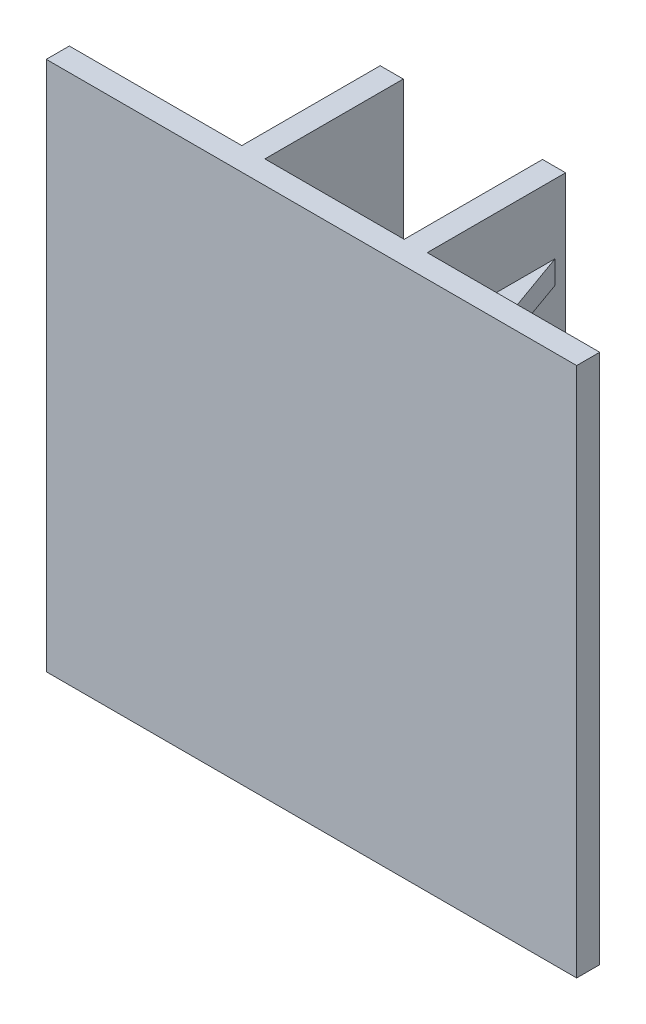
from build123d import *

# Parameters (mm, degrees)
SKETCH_1_W               = 5
SKETCH_1_H               = 115
EXTRUDE_1_DEPTH          = 30
EXTRUDE_1_2_DEPTH        = 30
SKETCH_1_3_W             = 115
SKETCH_1_3_H             = 115
EXTRUDE_2_DEPTH          = 5
CUT_EXTRUDE_1_DEPTH      = 22.5
RIB_1_REACH              = 88.675
SKETCH_4_WALL_W          = 214.94733798
SKETCH_4_WALL_H          = 5
RIB_2_REACH              = 119.1
SKETCH_7_WALL_W          = 265.932906068
SKETCH_7_WALL_H          = 5
MIRROR_3_COPY_1_REACH    = 119.1
MIRROR_3_COPY_1_SKETCH_W = 265.932906068
MIRROR_3_COPY_1_SKETCH_H = 5
MIRROR_3_COPY_2_REACH    = 119.1
MIRROR_3_COPY_2_SKETCH_W = 265.932906068
MIRROR_3_COPY_2_SKETCH_H = 5


with BuildPart() as part:
    # 스케치1 → 보스-돌출1 (new body)
    with BuildSketch(Plane.XY):
        with Locations((-17.6, 0)):
            Rectangle(SKETCH_1_W, SKETCH_1_H)
    extrude(amount=-EXTRUDE_1_DEPTH)



with BuildPart() as body_2:
    # 스케치1 → Extrude 1 2 (new body)
    with BuildSketch(Plane.XY):
        with Locations((17.6, 0)):
            Rectangle(SKETCH_1_W, SKETCH_1_H)
    extrude(amount=-EXTRUDE_1_2_DEPTH)


with BuildPart() as part_1:
    add(part.part)

    add(body_2.part)  # 보스-돌출2 merges body 2
    # 스케치1<3> → 보스-돌출2 (add)
    with BuildSketch(Plane.XY):
        Rectangle(SKETCH_1_3_W, SKETCH_1_3_H)
    extrude(amount=EXTRUDE_2_DEPTH)

    # 스케치3 → 컷-돌출1 (cut, symmetric)
    with BuildSketch(Plane(origin=(0, 0, 0), x_dir=(0, 0, -1), z_dir=(1, 0, 0))):
        with BuildLine():
            Line((15, 24), (30, 24))
            Line((30, 24), (30, 16))
            Line((30, 16), (15, 16))
            ThreePointArc((15, 16), (11, 20), (15, 24))
        make_face()
        with BuildLine():
            Line((30, -16), (30, -24))
            Line((30, -24), (15, -24))
            ThreePointArc((15, -24), (11, -20), (15, -16))
            Line((15, -16), (30, -16))
        make_face()
    extrude(amount=CUT_EXTRUDE_1_DEPTH, both=True, mode=Mode.SUBTRACT)

    # 스케치4 wall → 보강대1 (add, up to next)
    with BuildSketch(Plane(origin=(34, 0, -14), x_dir=(0.707106781187, 0, 0.707106781187), z_dir=(0.707106781187, 0, -0.707106781187)), mode=Mode.PRIVATE) as rib_1_sk1:
        Rectangle(SKETCH_4_WALL_W, SKETCH_4_WALL_H)
    rib_1_tool1 = extrude(rib_1_sk1.sketch, amount=-RIB_1_REACH, mode=Mode.PRIVATE) - part_1.part
    rib_1 = rib_1_tool1.solids().sort_by_distance((34, 0, -14))[0]
    add(rib_1)

    # 스케치7 wall → 보강대2 (add, up to next)
    with BuildSketch(Plane(origin=(25, 40, -14), x_dir=(0.336336396998, 0, 0.941741911595), z_dir=(0.941741911595, 0, -0.336336396998)), mode=Mode.PRIVATE) as rib_2_sk1:
        Rectangle(SKETCH_7_WALL_W, SKETCH_7_WALL_H)
    rib_2_tool1 = extrude(rib_2_sk1.sketch, amount=-RIB_2_REACH, mode=Mode.PRIVATE) - part_1.part
    rib_2 = rib_2_tool1.solids().sort_by_distance((25, 40, -14))[0]
    add(rib_2)

    # 대칭 복사1: 보강대1 across plane
    add(rib_1.mirror(Plane.ZY))

    # 대칭 복사2: 보강대2 across plane
    add(rib_2.mirror(Plane.ZY))

    # 대칭 복사3 copy 1 sketch → 대칭 복사3 copy 1 (add, up to next)
    with BuildSketch(Plane(origin=(-25, -40, -14), x_dir=(-0.336336396998, 0, 0.941741911595), z_dir=(-0.941741911595, 0, -0.336336396998)), mode=Mode.PRIVATE) as mirror_3_copy_1_sk1:
        Rectangle(MIRROR_3_COPY_1_SKETCH_W, MIRROR_3_COPY_1_SKETCH_H)
    mirror_3_copy_1_tool1 = extrude(mirror_3_copy_1_sk1.sketch, amount=-MIRROR_3_COPY_1_REACH, mode=Mode.PRIVATE) - part_1.part
    add(mirror_3_copy_1_tool1.solids().sort_by_distance((-25, -40, -14))[0])

    # 대칭 복사3 copy 2 sketch → 대칭 복사3 copy 2 (add, up to next)
    with BuildSketch(Plane(origin=(25, -40, -14), x_dir=(0.336336396998, 0, 0.941741911595), z_dir=(0.941741911595, 0, -0.336336396998)), mode=Mode.PRIVATE) as mirror_3_copy_2_sk1:
        Rectangle(MIRROR_3_COPY_2_SKETCH_W, MIRROR_3_COPY_2_SKETCH_H)
    mirror_3_copy_2_tool1 = extrude(mirror_3_copy_2_sk1.sketch, amount=-MIRROR_3_COPY_2_REACH, mode=Mode.PRIVATE) - part_1.part
    add(mirror_3_copy_2_tool1.solids().sort_by_distance((25, -40, -14))[0])


solid = part_1.part
